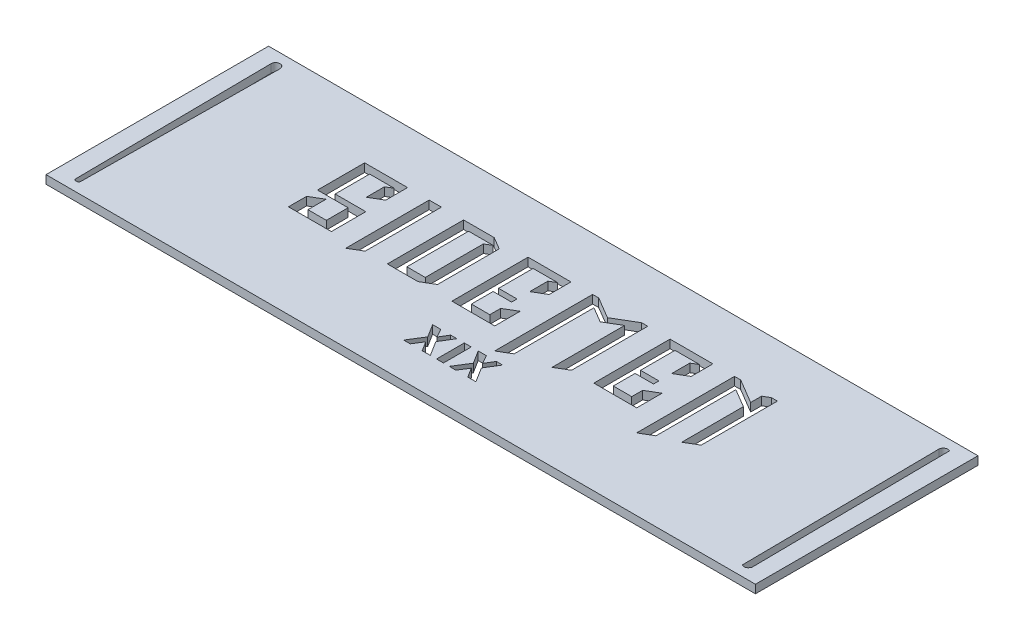
from build123d import *

# Parameters (mm, degrees)
SKETCH1_W           = 255
SKETCH1_H           = 80
BOSS_EXTRUDE1_DEPTH = 3
CUT_EXTRUDE1_REACH  = 135.661
CUT_EXTRUDE3_REACH  = 135.661
SKETCH5_W           = 2.5
SKETCH5_H           = 10
CUT_EXTRUDE4_REACH  = 135.661


with BuildPart() as part:
    # Sketch1 → Boss-Extrude1 (new body)
    with BuildSketch(Plane(origin=(0, 0, 0), x_dir=(1, 0, 0), z_dir=(0, 1, 0))):
        Rectangle(SKETCH1_W, SKETCH1_H)
    extrude(amount=BOSS_EXTRUDE1_DEPTH)

    # Sketch2 → Cut-Extrude1 (cut, up to next)
    with BuildSketch(Plane(origin=(0, 3, 0), x_dir=(1, 0, 0), z_dir=(0, 1, 0)), mode=Mode.PRIVATE) as cut_extrude1_sk1:
        with BuildLine():
            Line((-121.6, 35), (-120.862485914, -36.347634241))
            ThreePointArc((-120.862485914, -36.347634241), (-120, -36.6), (-119.137514086, -36.347634241))
            Line((-119.137514086, -36.347634241), (-118.4, 35))
            ThreePointArc((-118.4, 35), (-120, 36.6), (-121.6, 35))
        make_face()
    cut_extrude1_tool1 = extrude(cut_extrude1_sk1.sketch, amount=-CUT_EXTRUDE1_REACH, mode=Mode.PRIVATE) & part.part
    # Sketch2 → Cut-Extrude1 (cut, up to next)
    with BuildSketch(Plane(origin=(0, 3, 0), x_dir=(1, 0, 0), z_dir=(0, 1, 0)), mode=Mode.PRIVATE) as cut_extrude1_sk2:
        with BuildLine():
            Line((118.4, 35), (119.137514086, -36.347634241))
            ThreePointArc((119.137514086, -36.347634241), (120.76812191, -36.40356287), (121.6, -35))
            Line((121.6, -35), (120.862485914, 36.347634241))
            ThreePointArc((120.862485914, 36.347634241), (119.23187809, 36.40356287), (118.4, 35))
        make_face()
    cut_extrude1_tool2 = extrude(cut_extrude1_sk2.sketch, amount=-CUT_EXTRUDE1_REACH, mode=Mode.PRIVATE) & part.part
    add(cut_extrude1_tool1.solids().sort_by_distance((-120, 3, -3.555655))[0], mode=Mode.SUBTRACT)
    add(cut_extrude1_tool2.solids().sort_by_distance((120, 3, 0))[0], mode=Mode.SUBTRACT)

    # Sketch5 → Cut-Extrude3 (cut, up to next)
    with BuildSketch(Plane(origin=(0, 3, 0), x_dir=(1, 0, 0), z_dir=(0, 1, 0)), mode=Mode.PRIVATE) as cut_extrude3_sk1:
        Polygon((-2.574616468, -17.21123055), (-5.450050496, -21.933452772), (-2.157949801, -27.21123055), (-5.081126885, -27.21123055), (-7.210033135, -23.799772217), (-9.354130357, -27.21123055), (-11.741283135, -27.21123055), (-8.399269246, -21.896560411), (-11.324616468, -17.21123055), (-8.399269246, -17.21123055), (-6.663158135, -20.255935411), (-4.809859523, -17.21123055), align=None)
    cut_extrude3_tool1 = extrude(cut_extrude3_sk1.sketch, amount=-CUT_EXTRUDE3_REACH, mode=Mode.PRIVATE) & part.part
    # Sketch5 → Cut-Extrude3 (cut, up to next)
    with BuildSketch(Plane(origin=(0, 3, 0), x_dir=(1, 0, 0), z_dir=(0, 1, 0)), mode=Mode.PRIVATE) as cut_extrude3_sk2:
        with Locations((1.314272421, -22.21123055)):
            Rectangle(SKETCH5_W, SKETCH5_H)
    cut_extrude3_tool2 = extrude(cut_extrude3_sk2.sketch, amount=-CUT_EXTRUDE3_REACH, mode=Mode.PRIVATE) & part.part
    # Sketch5 → Cut-Extrude3 (cut, up to next)
    with BuildSketch(Plane(origin=(0, 3, 0), x_dir=(1, 0, 0), z_dir=(0, 1, 0)), mode=Mode.PRIVATE) as cut_extrude3_sk3:
        Polygon((13.814272421, -17.21123055), (10.938838393, -21.933452772), (14.230939088, -27.21123055), (11.307762004, -27.21123055), (9.178855754, -23.799772217), (7.034758532, -27.21123055), (4.647605754, -27.21123055), (7.989619643, -21.896560411), (5.064272421, -17.21123055), (7.989619643, -17.21123055), (9.725730754, -20.255935411), (11.579029365, -17.21123055), align=None)
    cut_extrude3_tool3 = extrude(cut_extrude3_sk3.sketch, amount=-CUT_EXTRUDE3_REACH, mode=Mode.PRIVATE) & part.part
    add(cut_extrude3_tool1.solids().sort_by_distance((-6.933837, 3, 22.286822))[0], mode=Mode.SUBTRACT)
    add(cut_extrude3_tool2.solids().sort_by_distance((1.314272, 3, 22.211231))[0], mode=Mode.SUBTRACT)
    add(cut_extrude3_tool3.solids().sort_by_distance((9.455051, 3, 22.286822))[0], mode=Mode.SUBTRACT)

    # Sketch6 → Cut-Extrude4 (cut, up to next)
    with BuildSketch(Plane(origin=(0, 3, 0), x_dir=(1, 0, 0), z_dir=(0, 1, 0)), mode=Mode.PRIVATE) as cut_extrude4_sk1:
        Polygon((-73.91185319, -6.440770216), (-73.91185319, 0.080968915), (-69.509679277, 2.689664567), (-69.509679277, -3.832074563), (-62.897360437, -3.832074563), (-62.897360437, 3.994012393), (-73.91185319, 3.994012393), (-73.91185319, 20.950534132), (-58.495186523, 20.950534132), (-58.495186523, 13.124447176), (-62.897360437, 10.515751523), (-62.897360437, 17.037490654), (-60.699292804, 18.34183848), (-69.509679277, 18.34183848), (-69.509679277, 5.950534132), (-58.495186523, 5.950534132), (-58.495186523, -6.440770216), align=None)
    cut_extrude4_tool1 = extrude(cut_extrude4_sk1.sketch, amount=-CUT_EXTRUDE4_REACH, mode=Mode.PRIVATE) & part.part
    # Sketch6 → Cut-Extrude4 (cut, up to next)
    with BuildSketch(Plane(origin=(0, 3, 0), x_dir=(1, 0, 0), z_dir=(0, 1, 0)), mode=Mode.PRIVATE) as cut_extrude4_sk2:
        Polygon((-50.723447393, -9.049465868), (-50.723447393, 20.950534132), (-46.32127348, 20.950534132), (-46.32127348, -6.440770216), align=None)
    cut_extrude4_tool2 = extrude(cut_extrude4_sk2.sketch, amount=-CUT_EXTRUDE4_REACH, mode=Mode.PRIVATE) & part.part
    # Sketch6 → Cut-Extrude4 (cut, up to next)
    with BuildSketch(Plane(origin=(0, 3, 0), x_dir=(1, 0, 0), z_dir=(0, 1, 0)), mode=Mode.PRIVATE) as cut_extrude4_sk3:
        Polygon((-38.356297635, -6.440770216), (-38.356297635, 20.950534132), (-27.341804881, 20.950534132), (-22.939630968, 18.34183848), (-22.939630968, -3.832074563), (-27.341804881, -6.440770216), align=None)
        Polygon((-27.341804881, -3.832074563), (-27.341804881, 17.037490654), (-25.143737248, 18.34183848), (-33.954123722, 18.34183848), (-33.954123722, -3.832074563), align=None, mode=Mode.SUBTRACT)
    cut_extrude4_tool3 = extrude(cut_extrude4_sk3.sketch, amount=-CUT_EXTRUDE4_REACH, mode=Mode.PRIVATE) & part.part
    # Sketch6 → Cut-Extrude4 (cut, up to next)
    with BuildSketch(Plane(origin=(0, 3, 0), x_dir=(1, 0, 0), z_dir=(0, 1, 0)), mode=Mode.PRIVATE) as cut_extrude4_sk4:
        Polygon((-15.167891838, -6.440770216), (-15.167891838, 20.950534132), (0.248774829, 20.950534132), (0.248774829, 13.124447176), (-4.153399084, 10.515751523), (-4.153399084, 17.037490654), (-1.955331451, 18.34183848), (-10.765717924, 18.34183848), (-10.765717924, 5.950534132), (-4.153399084, 5.950534132), (-4.153399084, 3.994012393), (-10.765717924, 3.994012393), (-10.765717924, -3.832074563), (-4.153399084, -3.832074563), (-4.153399084, 0.080968915), (0.248774829, 2.689664567), (0.248774829, -6.440770216), align=None)
    cut_extrude4_tool4 = extrude(cut_extrude4_sk4.sketch, amount=-CUT_EXTRUDE4_REACH, mode=Mode.PRIVATE) & part.part
    # Sketch6 → Cut-Extrude4 (cut, up to next)
    with BuildSketch(Plane(origin=(0, 3, 0), x_dir=(1, 0, 0), z_dir=(0, 1, 0)), mode=Mode.PRIVATE) as cut_extrude4_sk5:
        Polygon((8.02051396, -14.266857172), (8.02051396, 20.950534132), (10.22462024, 20.950534132), (17.929934249, 16.385316741), (25.641286906, 20.950534132), (27.839354539, 20.950534132), (27.839354539, -6.440770216), (23.437180626, -9.049465868), (23.437180626, 17.037490654), (17.929934249, 13.776621089), (12.422687873, 17.037490654), (12.422687873, -11.65816152), align=None)
    cut_extrude4_tool5 = extrude(cut_extrude4_sk5.sketch, amount=-CUT_EXTRUDE4_REACH, mode=Mode.PRIVATE) & part.part
    # Sketch6 → Cut-Extrude4 (cut, up to next)
    with BuildSketch(Plane(origin=(0, 3, 0), x_dir=(1, 0, 0), z_dir=(0, 1, 0)), mode=Mode.PRIVATE) as cut_extrude4_sk6:
        Polygon((35.846600916, -6.440770216), (35.846600916, 20.950534132), (51.263267583, 20.950534132), (51.263267583, 13.124447176), (46.86109367, 10.515751523), (46.86109367, 17.037490654), (49.059161303, 18.34183848), (40.248774829, 18.34183848), (40.248774829, 5.950534132), (46.86109367, 5.950534132), (46.86109367, 3.994012393), (40.248774829, 3.994012393), (40.248774829, -3.832074563), (46.86109367, -3.832074563), (46.86109367, 0.080968915), (51.263267583, 2.689664567), (51.263267583, -6.440770216), align=None)
    cut_extrude4_tool6 = extrude(cut_extrude4_sk6.sketch, amount=-CUT_EXTRUDE4_REACH, mode=Mode.PRIVATE) & part.part
    # Sketch6 → Cut-Extrude4 (cut, up to next)
    with BuildSketch(Plane(origin=(0, 3, 0), x_dir=(1, 0, 0), z_dir=(0, 1, 0)), mode=Mode.PRIVATE) as cut_extrude4_sk7:
        Polygon((59.035006713, -14.266857172), (59.035006713, 20.950534132), (61.239112993, 20.950534132), (70.049499467, 15.733142828), (70.049499467, 19.646186306), (72.2475671, 20.950534132), (74.45167338, 20.950534132), (74.45167338, -6.440770216), (70.049499467, -9.049465868), (70.049499467, 13.124447176), (63.437180626, 17.037490654), (63.437180626, -11.65816152), align=None)
    cut_extrude4_tool7 = extrude(cut_extrude4_sk7.sketch, amount=-CUT_EXTRUDE4_REACH, mode=Mode.PRIVATE) & part.part
    add(cut_extrude4_tool1.solids().sort_by_distance((-73.597535, 3, 3.179901))[0], mode=Mode.SUBTRACT)
    add(cut_extrude4_tool2.solids().sort_by_distance((-48.55571, 3, -6.592827))[0], mode=Mode.SUBTRACT)
    add(cut_extrude4_tool3.solids().sort_by_distance((-38.04198, 3, -7.254882))[0], mode=Mode.SUBTRACT)
    add(cut_extrude4_tool4.solids().sort_by_distance((-14.853574, 3, -7.254882))[0], mode=Mode.SUBTRACT)
    add(cut_extrude4_tool5.solids().sort_by_distance((8.424624, 3, -3.341838))[0], mode=Mode.SUBTRACT)
    add(cut_extrude4_tool6.solids().sort_by_distance((36.160919, 3, -7.254882))[0], mode=Mode.SUBTRACT)
    add(cut_extrude4_tool7.solids().sort_by_distance((59.419446, 3, -3.341838))[0], mode=Mode.SUBTRACT)


with BuildPart() as cut_extrude4_piece_1:
    # of the separate pieces the step leaves, piece 1, a body of its own (cut_extrude4_pieces)
    add(part.part.solids().sort_by_distance((-127.5, 0, 40))[0])


with BuildPart() as cut_extrude4_piece_2:
    # of the separate pieces the step leaves, piece 2, a body of its own (cut_extrude4_pieces)
    add(part.part.solids().sort_by_distance((-25.143737248, 0, -18.34183848))[0])


solid = Compound([cut_extrude4_piece_1.part, cut_extrude4_piece_2.part])
